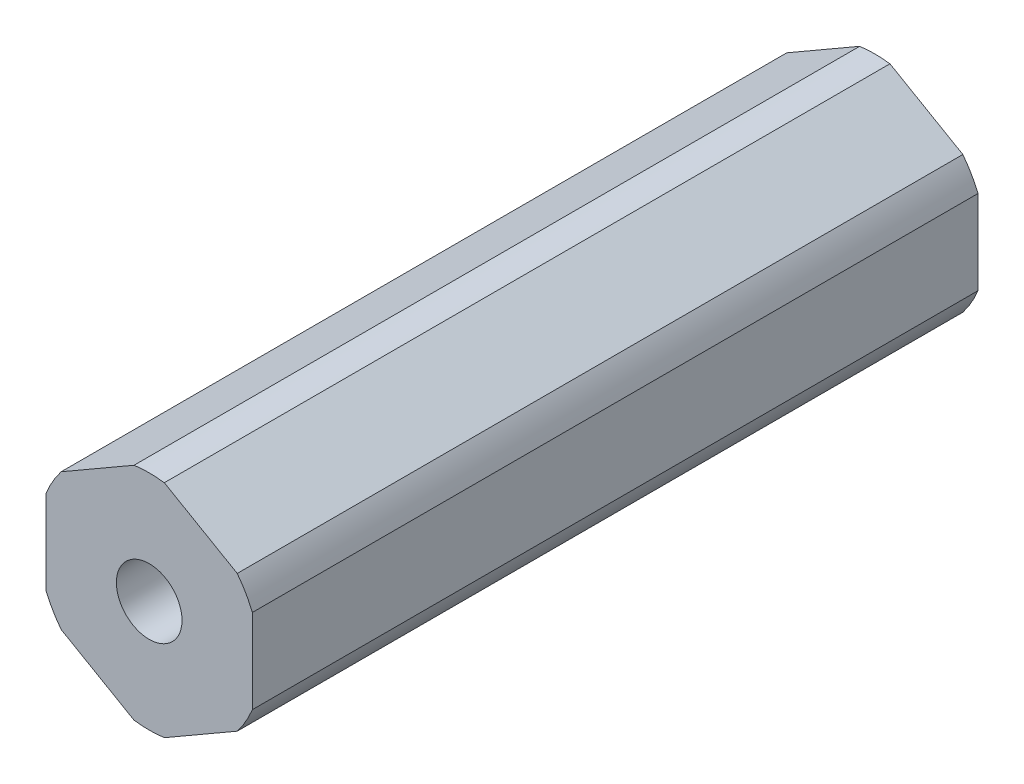
from build123d import *

# Parameters (mm, degrees)
BOSS_EXTRUDE1_DEPTH = 22.3266
SKETCH2_R           = 2.0193
CUT_EXTRUDE1_DEPTH  = 46.620860735


with BuildPart() as part:
    # Sketch1 → Boss-Extrude1 (new, symmetric)
    with BuildSketch(Plane.XY):
        with BuildLine():
            ThreePointArc((0.93173274, 6.79441227), (0, 6.858), (-0.93173274, 6.79441227))
            Line((-0.93173274, 6.79441227), (-5.41826726, 4.204110358))
            ThreePointArc((-5.41826726, 4.204110358), (-5.939202219, 3.429), (-6.35, 2.590301913))
            Line((-6.35, 2.590301913), (-6.35, -2.590301913))
            ThreePointArc((-6.35, -2.590301913), (-5.939202219, -3.429), (-5.41826726, -4.204110358))
            Line((-5.41826726, -4.204110358), (-0.93173274, -6.79441227))
            ThreePointArc((-0.93173274, -6.79441227), (0, -6.858), (0.93173274, -6.79441227))
            Line((0.93173274, -6.79441227), (5.41826726, -4.204110358))
            ThreePointArc((5.41826726, -4.204110358), (5.939202219, -3.429), (6.35, -2.590301913))
            Line((6.35, -2.590301913), (6.35, 2.590301913))
            ThreePointArc((6.35, 2.590301913), (5.939202219, 3.429), (5.41826726, 4.204110358))
            Line((5.41826726, 4.204110358), (0.93173274, 6.79441227))
        make_face()
    extrude(amount=BOSS_EXTRUDE1_DEPTH, both=True)

    # Sketch2 → Cut-Extrude1 (cut, through all)
    with BuildSketch(Plane.XY.offset(22.3266)):
        Circle(SKETCH2_R)
    extrude(amount=-CUT_EXTRUDE1_DEPTH, mode=Mode.SUBTRACT)


solid = part.part
